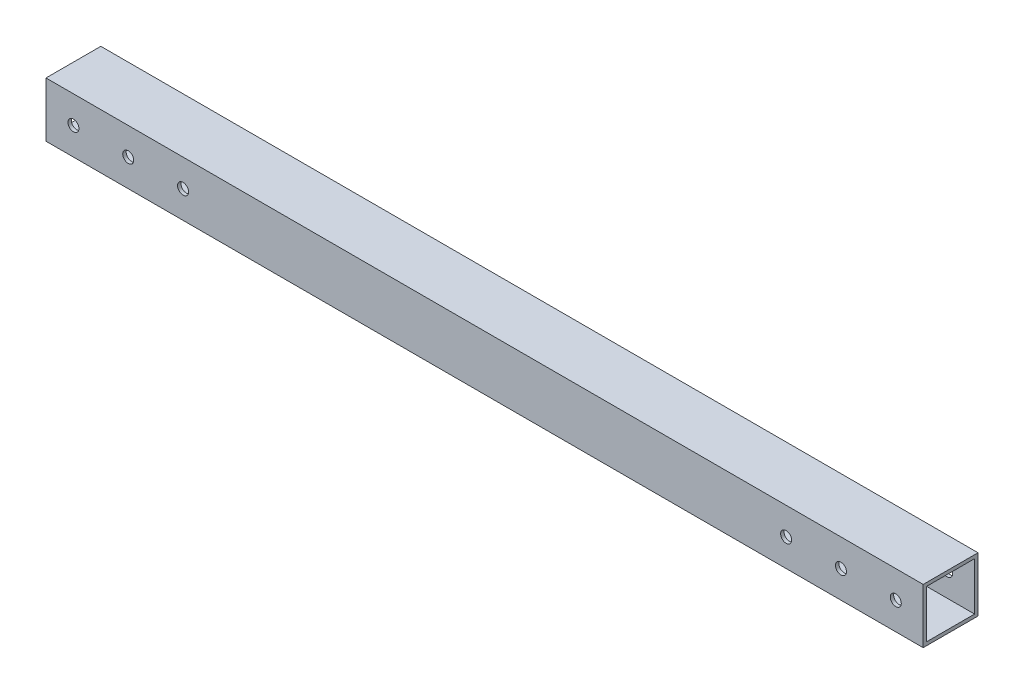
from build123d import *

# Parameters (mm, degrees)
BOSS_EXTRUDE1_DEPTH        = 203.2
BOSS_EXTRUDE1_DEPTH_BACK   = 203.2
SKETCH1_W                  = 25.4
SKETCH1_H                  = 25.4
SKETCH1_W_2                = 22.225
SKETCH1_H_2                = 22.225
F_7_0_201_DIAMETER_HOLE2_D = 5.1054


with BuildPart() as part:
    # Sketch1 → Boss-Extrude1 (new, two sides: drawn at the far end of the back side and taken through both)
    with BuildSketch(Plane(origin=(0, 0, 0), x_dir=(0, 0, -1), z_dir=(1, 0, 0)).offset(-BOSS_EXTRUDE1_DEPTH_BACK)):
        Rectangle(SKETCH1_W, SKETCH1_H)
        Rectangle(SKETCH1_W_2, SKETCH1_H_2, mode=Mode.SUBTRACT)
    extrude(amount=BOSS_EXTRUDE1_DEPTH + BOSS_EXTRUDE1_DEPTH_BACK)

    # #7 (0.201) Diameter Hole2 (through all)
    with Locations(Plane.XY.offset(12.7)):
        with Locations((190.5, 0), (165.1, 0), (139.7, 0), (-139.7, 0), (-165.1, 0), (-190.5, 0)):
            Hole(F_7_0_201_DIAMETER_HOLE2_D / 2)


solid = part.part
